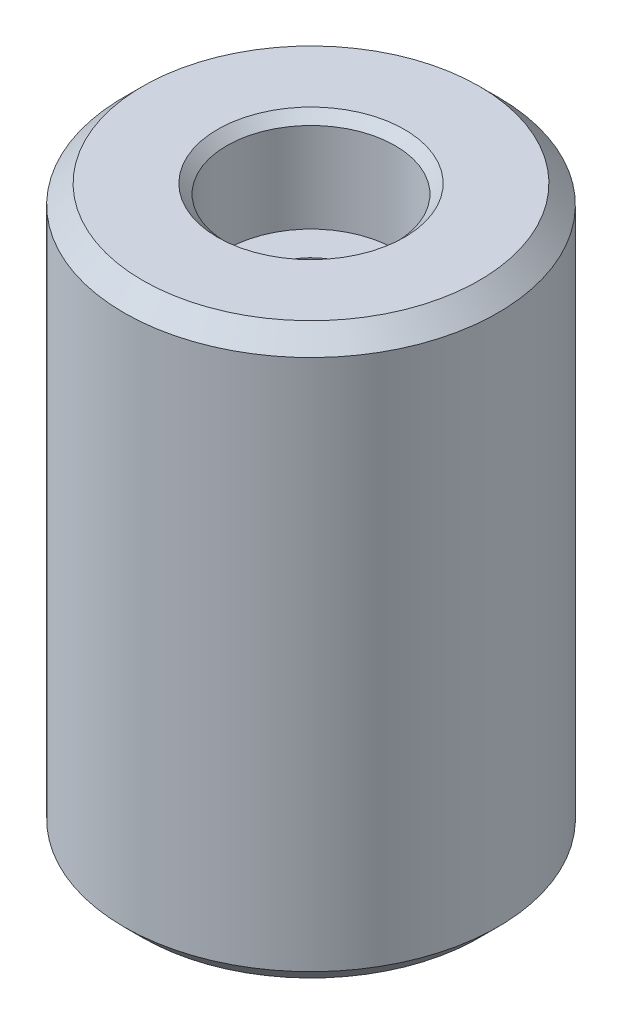
from build123d import *

# Parameters (mm, degrees)
SKETCH1_R                                            = 20
BOSS_EXTRUDE1_DEPTH                                  = 60.9
CBORE_FOR_M10_HEX_SOCKET_HEAD_CAP_SCREW1_D           = 10.5
CBORE_FOR_M10_HEX_SOCKET_HEAD_CAP_SCREW1_CBORE_D     = 18
CBORE_FOR_M10_HEX_SOCKET_HEAD_CAP_SCREW1_CBORE_DEPTH = 10.6
CHAMFER1_SIZE                                        = 2
CHAMFER2_SIZE                                        = 1
CHAMFER3_SIZE                                        = 1


with BuildPart() as part:
    # Sketch1 → Boss-Extrude1 (new body)
    with BuildSketch(Plane(origin=(0, 0, 0), x_dir=(1, 0, 0), z_dir=(0, 1, 0))):
        with Locations(Location((0, 0, 0), (0, 0, 270))):
            Circle(SKETCH1_R)
    extrude(amount=-BOSS_EXTRUDE1_DEPTH)

    # CBORE for M10 Hex Socket Head Cap Screw1 (through all)
    with Locations(Plane(origin=(0, 0, 0), x_dir=(1, 0, 0), z_dir=(0, 1, 0))):
        with Locations((0, 0)):
            CounterBoreHole(CBORE_FOR_M10_HEX_SOCKET_HEAD_CAP_SCREW1_D / 2, CBORE_FOR_M10_HEX_SOCKET_HEAD_CAP_SCREW1_CBORE_D / 2, CBORE_FOR_M10_HEX_SOCKET_HEAD_CAP_SCREW1_CBORE_DEPTH)

    # Chamfer1
    chamfer1_edges = [part.edges().sort_by_distance(p)[0] for p in [
        (0, 0, -20),
        (0, -60.9, -20),
    ]]
    chamfer(chamfer1_edges, length=CHAMFER1_SIZE)

    # Chamfer2
    chamfer2_edges = [part.edges().sort_by_distance(p)[0] for p in [
        (-9, 0, 0),
    ]]
    chamfer(chamfer2_edges, length=CHAMFER2_SIZE)

    # Chamfer3
    chamfer3_edges = [part.edges().sort_by_distance(p)[0] for p in [
        (5.25, -60.9, 0),
    ]]
    chamfer(chamfer3_edges, length=CHAMFER3_SIZE)


solid = part.part
